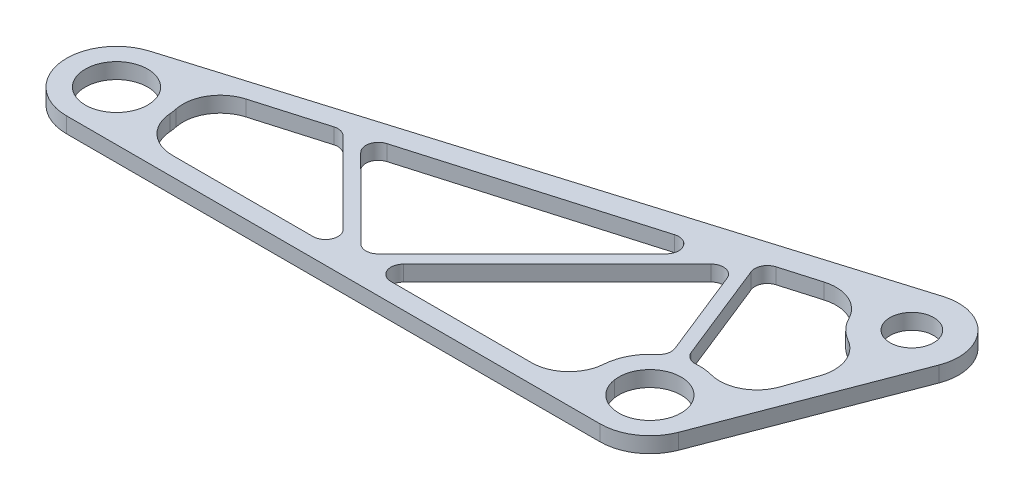
from build123d import *

# Parameters (mm, degrees)
SKETCH1_R           = 6.35
SKETCH1_R_2         = 4.445
BOSS_EXTRUDE4_DEPTH = 3.175
FILLET1_R           = 7.62
FILLET2_R           = 2.54


with BuildPart() as part:
    # Sketch1 → Boss-Extrude4 (new body)
    with BuildSketch(Plane(origin=(0, 0, 0), x_dir=(1, 0, 0), z_dir=(0, 1, 0))):
        with BuildLine():
            ThreePointArc((132.708902298, 34.70274992), (130.780561186, 44.591665065), (121.053534347, 47.21732518))
            Line((121.053534347, 47.21732518), (-2.940598336, 9.725146859))
            ThreePointArc((-2.940598336, 9.725146859), (-10.050698784, -1.486288652), (0, -10.16))
            Line((0, -10.16), (108.585, -10.16))
            ThreePointArc((108.585, -10.16), (114.347311535, -8.367877017), (118.076794146, -3.623733419))
            Line((118.076794146, -3.623733419), (132.708902298, 34.70274992))
        make_face()
        with BuildLine():
            Line((5.835638087, 8.316906163), (30.582028831, 15.535454115))
            Line((30.582028831, 15.535454115), (52.49530672, -6.35))
            Line((52.49530672, -6.35), (7.931147458, -6.35))
            ThreePointArc((7.931147458, -6.35), (10.057864095, 1.437000294), (5.835638087, 8.316906163))
        make_face(mode=Mode.SUBTRACT)
        Polygon((33.363906977, 16.346930867), (92.350223331, 33.55330078), (54.291359033, -4.553949138), align=None, mode=Mode.SUBTRACT)
        with BuildLine():
            Line((94.419089716, 32.030410831), (103.665421891, 8.889507929))
            ThreePointArc((103.665421891, 8.889507929), (98.617756781, 1.969685918), (100.653852542, -6.35))
            Line((100.653852542, -6.35), (56.087411343, -6.35))
            Line((56.087411343, -6.35), (94.419089716, 32.030410831))
        make_face(mode=Mode.SUBTRACT)
        with BuildLine():
            Line((96.107879032, 34.649412861), (114.478426945, 40.008120819))
            ThreePointArc((114.478426945, 40.008120819), (116.909216359, 31.534937584), (125.250600093, 28.684518542))
            Line((125.250600093, 28.684518542), (117.182643526, 5.413513258))
            ThreePointArc((117.182643526, 5.413513258), (112.325487778, 9.446393554), (106.024105012, 9.831958953))
            Line((106.024105012, 9.831958953), (96.107879032, 34.649412861))
        make_face(mode=Mode.SUBTRACT)
        with Locations(Location((108.585, 0, 0), (0, 0, 270))):
            Circle(SKETCH1_R, mode=Mode.SUBTRACT)
        with Locations(Location((123.810345287, 38.1, 0), (0, 0, 270))):
            Circle(SKETCH1_R_2, mode=Mode.SUBTRACT)
        with Locations(Location((0, 0, 0), (0, 0, 270))):
            Circle(SKETCH1_R, mode=Mode.SUBTRACT)
    extrude(amount=-BOSS_EXTRUDE4_DEPTH)

    # Fillet1
    fillet1_edges = [part.edges().sort_by_distance(p)[0] for p in [
        (5.835638087, -1.5875, -8.316906163),
        (7.931147458, -1.5875, 6.35),
        (100.653852542, -1.5875, 6.35),
        (125.250600093, -1.5875, -28.684518542),
        (114.478426945, -1.5875, -40.008120819),
        (117.182643526, -1.5875, -5.413513258),
    ]]
    fillet(fillet1_edges, radius=FILLET1_R)

    # Fillet2
    fillet2_edges = [part.edges().sort_by_distance(p)[0] for p in [
        (92.350223331, -1.5875, -33.55330078),
        (33.363906977, -1.5875, -16.346930867),
        (54.291359033, -1.5875, 4.553949138),
        (30.582028831, -1.5875, -15.535454115),
        (52.49530672, -1.5875, 6.35),
        (103.665421891, -1.5875, -8.889507929),
        (94.419089716, -1.5875, -32.030410831),
        (56.087411343, -1.5875, 6.35),
        (96.107879032, -1.5875, -34.649412861),
        (106.024105012, -1.5875, -9.831958953),
    ]]
    fillet(fillet2_edges, radius=FILLET2_R)


solid = part.part
